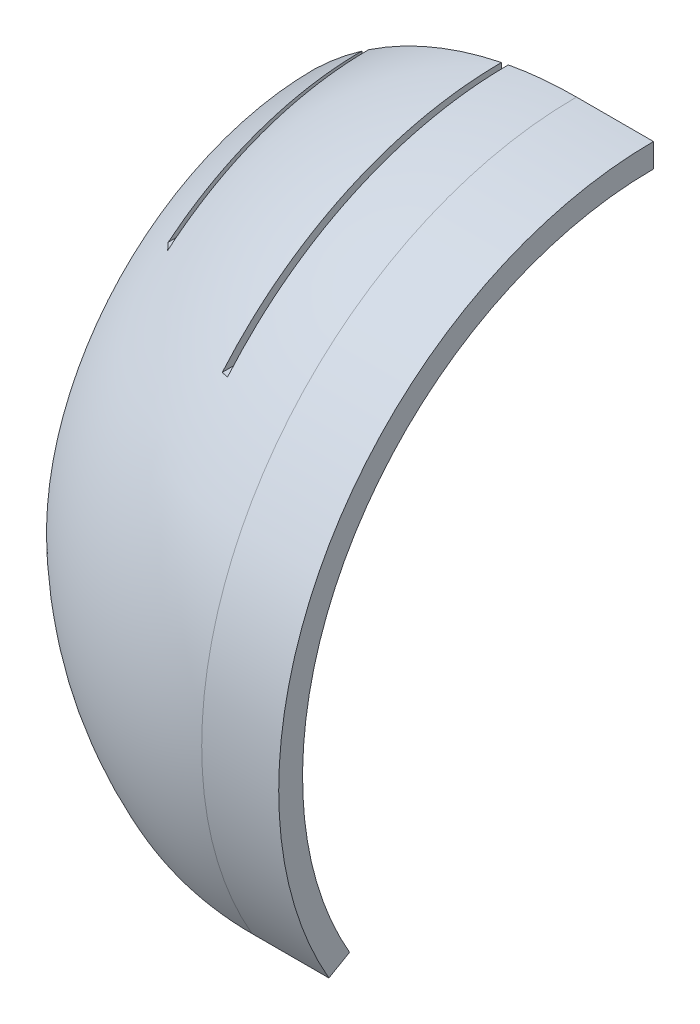
from build123d import *

# Parameters (mm, degrees)
CUT_EXTRUDE_1_DEPTH      = 96.262794416
CUT_EXTRUDE_1_DEPTH_BACK = 96.262794416
SKETCH_2_W               = 55
SKETCH_2_H               = 110
CUT_EXTRUDE_2_DEPTH      = 96.262794416
CUT_EXTRUDE_2_DEPTH_BACK = 96.262794416
SKETCH_3_W               = 23.273135213
SKETCH_3_H               = 110
CUT_EXTRUDE_3_DEPTH      = 87.788536109
SKETCH_5_W               = 1
SKETCH_5_H               = 20
CUT_EXTRUDE_4_DEPTH      = 87.788536109
SKETCH_6_W               = 11.3
SKETCH_6_H               = 3.5
CUT_EXTRUDE_START        = -10
CUT_EXTRUDE_5_DEPTH      = 10
CUT_EXTRUDE_6_DEPTH      = 10


with BuildPart() as part:
    # 草图1 → 旋转8 (revolve)
    with BuildSketch(Plane.XY):
        with BuildLine():
            Line((0, 55), (0, 51.5))
            ThreePointArc((0, 51.5), (-51.5, 0), (0, -51.5))
            Line((0, -51.5), (0, -55))
            ThreePointArc((0, -55), (-55, 0), (0, 55))
        make_face()
    revolve(axis=Axis((0, 0, 0), (0, 1, 0)))

    # 草图2 → 切除-拉伸1 (cut, two sides: drawn at the far end of the back side and taken through both)
    with BuildSketch(Plane.XY.offset(-CUT_EXTRUDE_1_DEPTH_BACK)):
        with Locations((27.5, 0)):
            Rectangle(SKETCH_2_W, SKETCH_2_H)
    extrude(amount=CUT_EXTRUDE_1_DEPTH + CUT_EXTRUDE_1_DEPTH_BACK, mode=Mode.SUBTRACT)

    # 草图3 → 切除-拉伸2 (cut, two sides: drawn at the far end of the back side and taken through both)
    with BuildSketch(Plane.XY.offset(-CUT_EXTRUDE_2_DEPTH_BACK)):
        with Locations((-50.136567607, 0)):
            Rectangle(SKETCH_3_W, SKETCH_3_H)
    extrude(amount=CUT_EXTRUDE_2_DEPTH + CUT_EXTRUDE_2_DEPTH_BACK, mode=Mode.SUBTRACT)

    # 草图4 → 切除-拉伸3 (cut, through all)
    with BuildSketch(Plane.ZY.offset(38.5)):
        with BuildLine():
            Line((0, 0), (0, 64.529887393))
            ThreePointArc((0, 64.529887393), (-55.884521786, -32.264943697), (55.884521786, -32.264943697))
            Line((55.884521786, -32.264943697), (0, 0))
        make_face()
    extrude(amount=-CUT_EXTRUDE_3_DEPTH, mode=Mode.SUBTRACT)

    # 草图5 → 切除-拉伸4 (cut, through all)
    with BuildSketch(Plane(origin=(0, 0, 0), x_dir=(-1, 0, 0), z_dir=(0, 0, -1))):
        with Locations((31, 45)):
            Rectangle(SKETCH_5_W, SKETCH_5_H)
        with Locations((10.5, 45)):
            Rectangle(SKETCH_5_W, SKETCH_5_H)
    extrude(amount=-CUT_EXTRUDE_4_DEPTH, mode=Mode.SUBTRACT)

    # 草图6 → 旋转9 (revolve)
    with BuildSketch(Plane.XY, mode=Mode.PRIVATE) as revolve_9_sk:
        with Locations((5.65, 53.25)):
            Rectangle(SKETCH_6_W, SKETCH_6_H)
    revolve(revolve_9_sk.sketch.rotate(Axis((0, 0, 0), (1, 0, 0)), 90), axis=Axis((0, 0, 0), (1, 0, 0)))

    # 草图7 → 切除-拉伸5 (cut)
    with BuildSketch(Plane.ZY.offset(CUT_EXTRUDE_START)):
        with BuildLine():
            Line((0, 55), (0, 0))
            Line((0, 0), (47.631397208, -27.5))
            ThreePointArc((47.631397208, -27.5), (-47.631397208, -27.5), (0, 55))
        make_face()
    extrude(amount=CUT_EXTRUDE_5_DEPTH, mode=Mode.SUBTRACT)

    # 草图8 → 切除-拉伸6 (cut)
    with BuildSketch(Plane.ZY.offset(-10).offset(CUT_EXTRUDE_START)):
        with BuildLine():
            Line((0, 55), (0, 0))
            Line((0, 0), (47.631397208, -27.5))
            ThreePointArc((47.631397208, -27.5), (-47.631397208, -27.5), (0, 55))
        make_face()
    extrude(amount=CUT_EXTRUDE_6_DEPTH, mode=Mode.SUBTRACT)


solid = part.part
